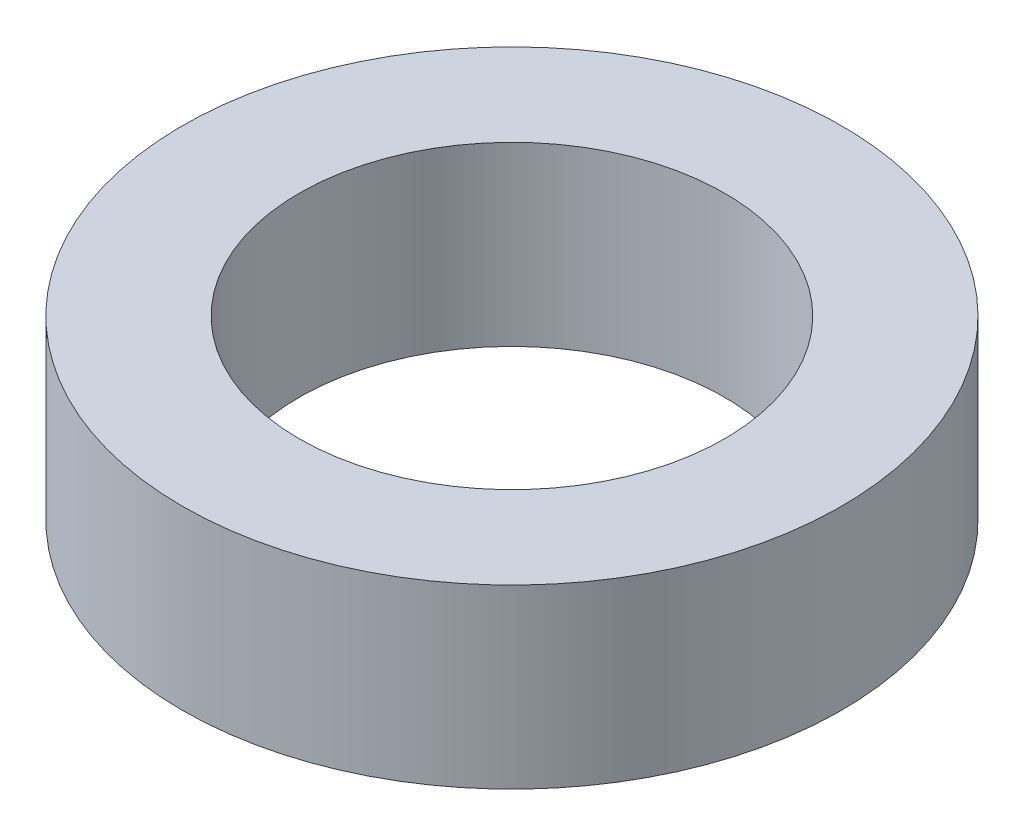
from build123d import *

# Parameters (mm, degrees)
SKETCH1_R           = 5.5
SKETCH1_R_2         = 3.55
BOSS_EXTRUDE1_DEPTH = 2.95


with BuildPart() as part:
    # Sketch1 → Boss-Extrude1 (new body)
    with BuildSketch(Plane(origin=(0, 0, 0), x_dir=(1, 0, 0), z_dir=(0, 1, 0))):
        with Locations(Location((0, 0, 0), (0, 0, 270))):
            Circle(SKETCH1_R)
        with Locations(Location((0, 0, 0), (0, 0, 270))):
            Circle(SKETCH1_R_2, mode=Mode.SUBTRACT)
    extrude(amount=BOSS_EXTRUDE1_DEPTH)


solid = part.part
